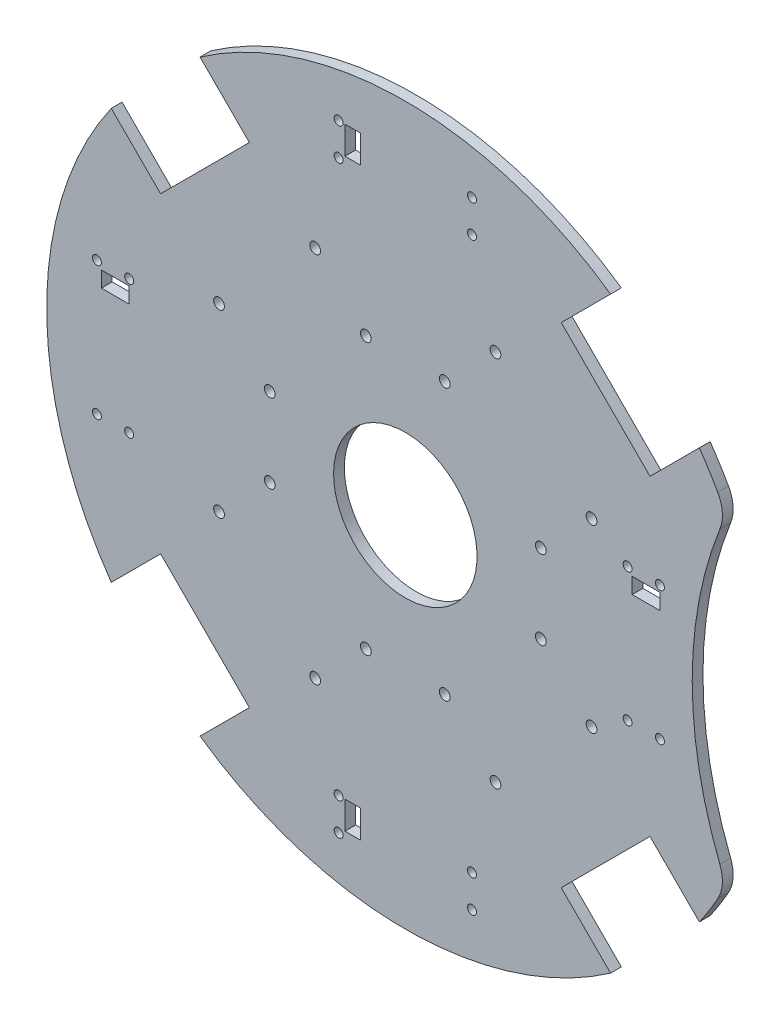
from build123d import *

# Parameters (mm, degrees)
CROQUIS1_R              = 100
SALIENTE_EXTRUIR1_DEPTH = 3
CROQUIS3_R              = 110
CORTAR_EXTRUIR1_DEPTH   = 3
REDONDEO1_R             = 10
CROQUIS4_R              = 1.5
CORTAR_EXTRUIR2_DEPTH   = 142.453172607
CROQUIS5_R              = 1.25
CROQUIS5_W              = 4.4
CROQUIS5_H              = 7.75
CROQUIS5_W_2            = 7.75
CROQUIS5_H_2            = 4.4
CORTAR_EXTRUIR3_DEPTH   = 142.453172607
CROQUIS6_R              = 20
CORTAR_EXTRUIR4_DEPTH   = 142.453172607


with BuildPart() as part:
    # Croquis1 → Saliente-Extruir1 (new body)
    with BuildSketch(Plane.XY):
        Circle(CROQUIS1_R)
    extrude(amount=SALIENTE_EXTRUIR1_DEPTH)

    # Croquis3 → Cortar-Extruir1 (cut)
    with BuildSketch(Plane.XY.offset(3)):
        with Locations((190, 0)):
            Circle(CROQUIS3_R)
    extrude(amount=-CORTAR_EXTRUIR1_DEPTH, mode=Mode.SUBTRACT)

    # Redondeo1
    redondeo1_edges = [part.edges().sort_by_distance(p)[0] for p in [
        (89.473684211, -44.659375654, 1.5),
        (89.473684211, 44.659375654, 1.5),
    ]]
    fillet(redondeo1_edges, radius=REDONDEO1_R)

    # Croquis4 → Cortar-Extruir2 (cut, through all)
    with BuildSketch(Plane.XY.offset(3)):
        with Locations((-10.995510447, 37.794857454)):
            Circle(CROQUIS4_R)
        with Locations((-51.936993078, -25.137646071)):
            Circle(CROQUIS4_R)
        with Locations((-25.137646071, -51.936993078)):
            Circle(CROQUIS4_R)
        with Locations((-10.995510447, -37.794857454)):
            Circle(CROQUIS4_R)
        with Locations((-37.794857454, -10.995510447)):
            Circle(CROQUIS4_R)
        with Locations((-37.794857454, 10.995510447)):
            Circle(CROQUIS4_R)
        with Locations((-51.936993078, 25.137646071)):
            Circle(CROQUIS4_R)
        with Locations((-25.137646071, 51.936993078)):
            Circle(CROQUIS4_R)
        with Locations((37.794857454, 10.995510447)):
            Circle(CROQUIS4_R)
        with Locations((10.995510447, 37.794857454)):
            Circle(CROQUIS4_R)
        with Locations((25.137646071, 51.936993078)):
            Circle(CROQUIS4_R)
        with Locations((51.936993078, 25.137646071)):
            Circle(CROQUIS4_R)
        with Locations((10.995510447, -37.794857454)):
            Circle(CROQUIS4_R)
        with Locations((37.794857454, -10.995510447)):
            Circle(CROQUIS4_R)
        with Locations((51.936993078, -25.137646071)):
            Circle(CROQUIS4_R)
        with Locations((25.137646071, -51.936993078)):
            Circle(CROQUIS4_R)
        Polygon((-83.085046789, -58.336309448), (-58.336309448, -83.085046789), (-43.487067043, -68.235804385), (-68.235804385, -43.487067043), align=None)
        Polygon((-58.336309448, 83.085046789), (-43.487067043, 68.235804385), (-68.235804385, 43.487067043), (-83.085046789, 58.336309448), align=None)
        Polygon((83.085046789, 58.336309448), (68.235804385, 43.487067043), (43.487067043, 68.235804385), (58.336309448, 83.085046789), align=None)
        Polygon((58.336309448, -83.085046789), (43.487067043, -68.235804385), (68.235804385, -43.487067043), (83.085046789, -58.336309448), align=None)
    extrude(amount=-CORTAR_EXTRUIR2_DEPTH, mode=Mode.SUBTRACT)

    # Croquis5 → Cortar-Extruir3 (cut, through all)
    with BuildSketch(Plane.XY.offset(3)):
        with Locations((-86, 18.59)):
            Circle(CROQUIS5_R)
        with Locations((-77, 18.59)):
            Circle(CROQUIS5_R)
        with Locations(Location((-77, -18.59, 0), (0, 0, 180))):
            Circle(CROQUIS5_R)
        with Locations(Location((-86, -18.59, 0), (0, 0, 180))):
            Circle(CROQUIS5_R)
        with Locations((18.59, 77)):
            Circle(CROQUIS5_R)
        with Locations((18.59, 86)):
            Circle(CROQUIS5_R)
        with Locations(Location((-18.59, 86, 0), (0, 0, 180))):
            Circle(CROQUIS5_R)
        with Locations(Location((-18.59, 77, 0), (0, 0, 180))):
            Circle(CROQUIS5_R)
        with Locations((62, 18.59)):
            Circle(CROQUIS5_R)
        with Locations((71, 18.59)):
            Circle(CROQUIS5_R)
        with Locations((62, -18.59)):
            Circle(CROQUIS5_R)
        with Locations((71, -18.59)):
            Circle(CROQUIS5_R)
        with Locations((-18.59, -77)):
            Circle(CROQUIS5_R)
        with Locations((-18.59, -86)):
            Circle(CROQUIS5_R)
        with Locations(Location((18.59, -86, 0), (0, 0, 180))):
            Circle(CROQUIS5_R)
        with Locations(Location((18.59, -77, 0), (0, 0, 180))):
            Circle(CROQUIS5_R)
        with Locations((-14.64, 82.125)):
            Rectangle(CROQUIS5_W, CROQUIS5_H)
        with Locations((-80.875, 14.64)):
            Rectangle(CROQUIS5_W_2, CROQUIS5_H_2)
        with Locations((67.125, 14.64)):
            Rectangle(CROQUIS5_W_2, CROQUIS5_H_2)
        with Locations((-14.64, -80.875)):
            Rectangle(CROQUIS5_W, CROQUIS5_H)
    extrude(amount=-CORTAR_EXTRUIR3_DEPTH, mode=Mode.SUBTRACT)

    # Croquis6 → Cortar-Extruir4 (cut, through all)
    with BuildSketch(Plane(origin=(0, 0, 0), x_dir=(-1, 0, 0), z_dir=(0, 0, -1))):
        Circle(CROQUIS6_R)
    extrude(amount=-CORTAR_EXTRUIR4_DEPTH, mode=Mode.SUBTRACT)


solid = part.part
